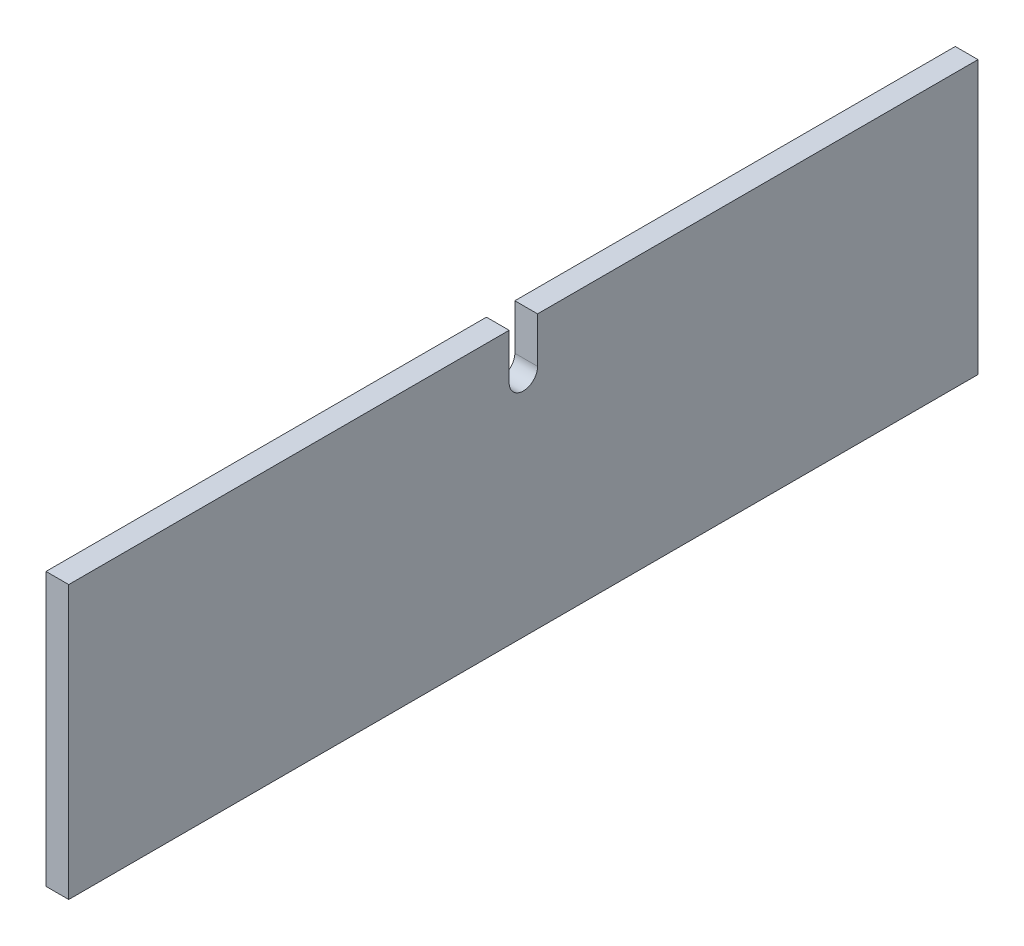
from build123d import *

# Parameters (mm, degrees)
BOSS_EXTRUDE1_DEPTH = 25.4


with BuildPart() as part:
    # Sketch1 → Boss-Extrude1 (new body)
    with BuildSketch(Plane(origin=(0, 0, 0), x_dir=(0, 0, -1), z_dir=(1, 0, 0))):
        with BuildLine():
            ThreePointArc((15.875, 0), (0, -15.875), (-15.875, 0))
            Line((-15.875, 0), (-15.875, 50.8))
            Line((-15.875, 50.8), (-508, 50.8))
            Line((-508, 50.8), (-508, -254))
            Line((-508, -254), (508, -254))
            Line((508, -254), (508, 50.8))
            Line((508, 50.8), (15.875, 50.8))
            Line((15.875, 50.8), (15.875, 0))
        make_face()
    extrude(amount=BOSS_EXTRUDE1_DEPTH)


solid = part.part
